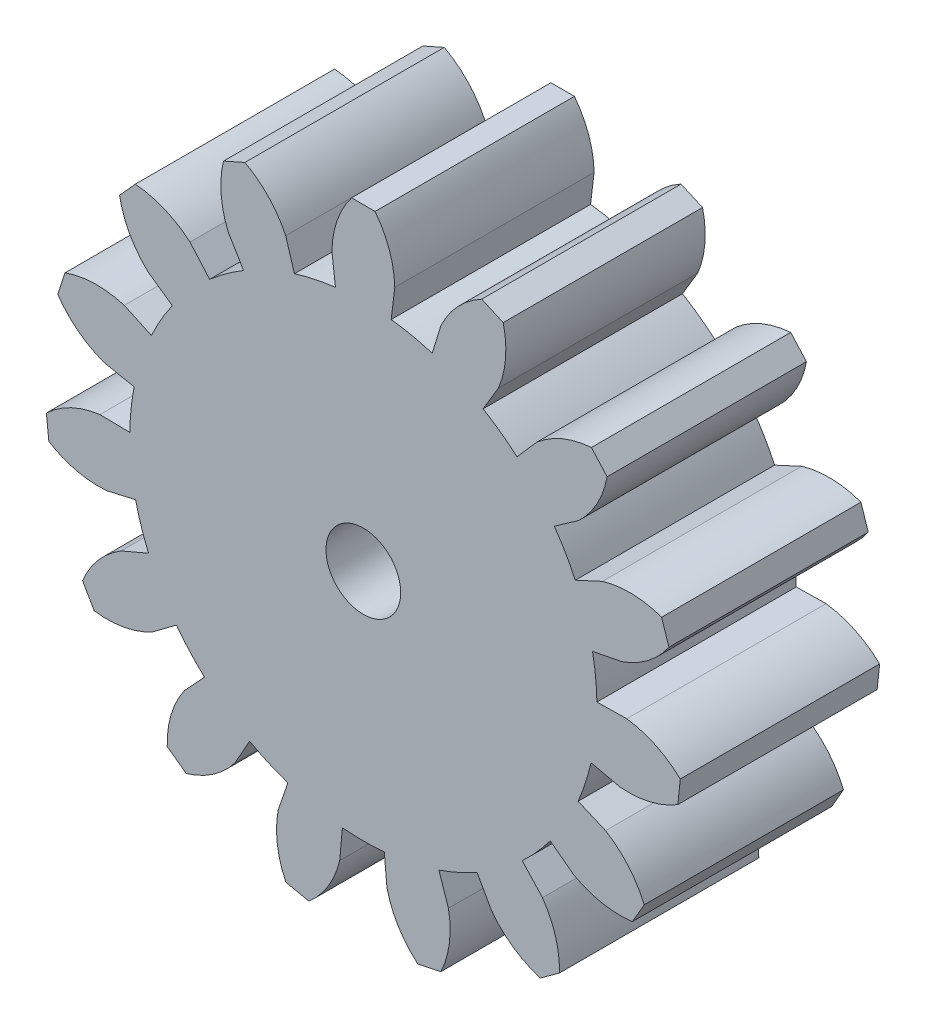
from build123d import *

# Parameters (mm, degrees)
SKETCH2_R           = 9.375
BOSS_EXTRUDE1_DEPTH = 8
BOSS_EXTRUDE2_DEPTH = 8
CIRPATTERN1_COUNT   = 15
SKETCH4_R           = 1.5
CUT_EXTRUDE1_DEPTH  = 8


with BuildPart() as part:
    # Sketch2 → Boss-Extrude1 (new body)
    with BuildSketch(Plane.XY):
        Circle(SKETCH2_R)
    extrude(amount=BOSS_EXTRUDE1_DEPTH)

    # Sketch3 → Boss-Extrude2 (add)
    with BuildSketch(Plane.XY.offset(8)):
        with BuildLine():
            Line((0, 0), (1.26165998, 10.496446927))
            ThreePointArc((1.26165998, 10.496446927), (1.046763133, 11.682170305), (0.471921711, 12.741263277))
            Line((0.471921711, 12.741263277), (-0.471921711, 12.741263277))
            ThreePointArc((-0.471921711, 12.741263277), (-1.046763133, 11.682170305), (-1.26165998, 10.496446927))
            Line((-1.26165998, 10.496446927), (0, 0))
        make_face()
    boss_extrude2 = extrude(amount=-BOSS_EXTRUDE2_DEPTH)

    # CirPattern1: Boss-Extrude2 ×15 about axis
    cirpattern1_axis = Axis((0, 0, 0), (0, 0, 1))
    for i in range(1, CIRPATTERN1_COUNT):
        add(boss_extrude2.rotate(cirpattern1_axis, i * 360 / CIRPATTERN1_COUNT))

    # Sketch4 → Cut-Extrude1 (cut)
    with BuildSketch(Plane.XY.offset(8)):
        Circle(SKETCH4_R)
    extrude(amount=-CUT_EXTRUDE1_DEPTH, mode=Mode.SUBTRACT)


solid = part.part
